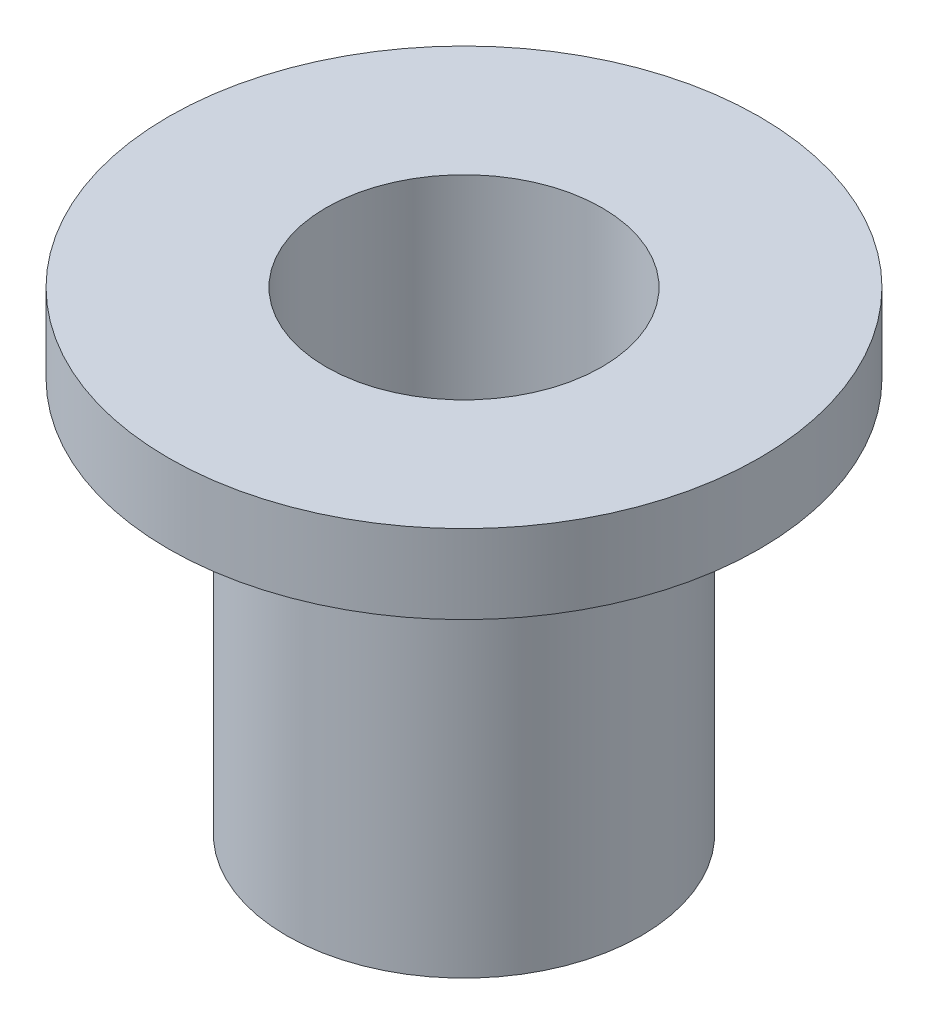
from build123d import *

# Parameters (mm, degrees)
SKETCH2_R           = 4.5
SKETCH2_R_2         = 3.5
BOSS_EXTRUDE1_DEPTH = 10
SKETCH3_R           = 7.5
SKETCH3_R_2         = 3.5
BOSS_EXTRUDE2_DEPTH = 2


with BuildPart() as part:
    # Sketch2 → Boss-Extrude1 (new body)
    with BuildSketch(Plane(origin=(0, 0, 0), x_dir=(1, 0, 0), z_dir=(0, 1, 0))):
        with Locations(Location((0, 0, 0), (0, 0, 270))):
            Circle(SKETCH2_R)
        with Locations(Location((0, 0, 0), (0, 0, 270))):
            Circle(SKETCH2_R_2, mode=Mode.SUBTRACT)
    extrude(amount=BOSS_EXTRUDE1_DEPTH)

    # Sketch3 → Boss-Extrude2 (add)
    with BuildSketch(Plane(origin=(0, 10, 0), x_dir=(1, 0, 0), z_dir=(0, 1, 0))):
        with Locations(Location((0, 0, 0), (0, 0, 270))):
            Circle(SKETCH3_R)
        with Locations(Location((0, 0, 0), (0, 0, 270))):
            Circle(SKETCH3_R_2, mode=Mode.SUBTRACT)
    extrude(amount=BOSS_EXTRUDE2_DEPTH)


solid = part.part
